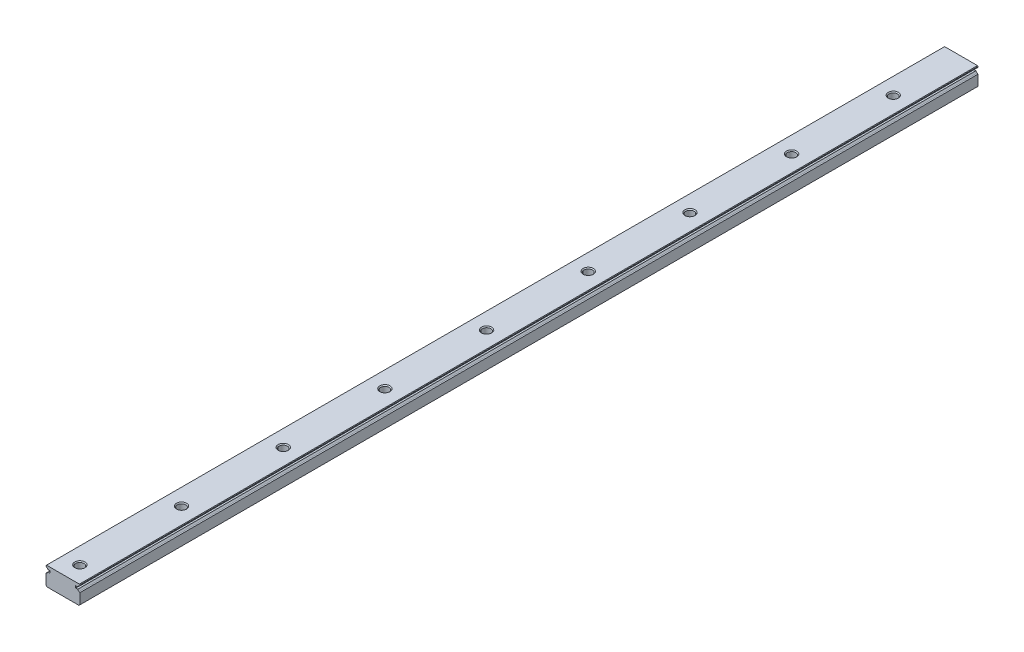
from build123d import *

# Parameters (mm, degrees)
ESQUISSE1_W             = 20
ESQUISSE1_H             = 530
BOSS_EXTRU_1_DEPTH      = 11
ENL_V_MAT_EXTRU_1_DEPTH = 531.208449574
ENL_V_MAT_EXTRU_2_DEPTH = 531.208449574
ENL_V_MAT_EXTRU_3_DEPTH = 531.208449574
ENL_V_MAT_EXTRU_4_DEPTH = 531.208449574
PER_AGE1_D              = 4.917
PER_AGE2_D              = 4.917
CHANFREIN1_SIZE         = 0.5415
CHANFREIN2_SIZE         = 0.3


with BuildPart() as part:
    # Esquisse1 → Boss.-Extru.1 (new body)
    with BuildSketch(Plane.XZ):
        with Locations((0, -15)):
            Rectangle(ESQUISSE1_W, ESQUISSE1_H)
    extrude(amount=-BOSS_EXTRU_1_DEPTH)

    # Esquisse2 → Enlèv. mat.-Extru.1 (cut, through all)
    with BuildSketch(Plane(origin=(0, 0, -280), x_dir=(-1, 0, 0), z_dir=(0, 0, -1))):
        with BuildLine():
            Line((10, 7.9), (10, 10.22385))
            Line((10, 10.22385), (9.440021531, 9.900556887))
            ThreePointArc((9.440021531, 9.900556887), (9.015681976, 9.557293765), (8.71772889, 9.1))
            Line((8.71772889, 9.1), (7.5, 9.1))
            Line((7.5, 9.1), (7.5, 7.9))
            Line((7.5, 7.9), (10, 7.9))
        make_face()
    extrude(amount=-ENL_V_MAT_EXTRU_1_DEPTH, mode=Mode.SUBTRACT)

    # Esquisse3 → Enlèv. mat.-Extru.2 (cut, through all)
    with BuildSketch(Plane(origin=(0, 0, -280), x_dir=(-1, 0, 0), z_dir=(0, 0, -1))):
        with BuildLine():
            Line((9.440021531, 7.099443113), (10, 6.77615))
            Line((10, 6.77615), (10, 7.9))
            Line((10, 7.9), (8.71772889, 7.9))
            ThreePointArc((8.71772889, 7.9), (9.015681976, 7.442706235), (9.440021531, 7.099443113))
        make_face()
    extrude(amount=-ENL_V_MAT_EXTRU_2_DEPTH, mode=Mode.SUBTRACT)

    # Esquisse4 → Enlèv. mat.-Extru.3 (cut, through all)
    with BuildSketch(Plane(origin=(0, 0, -280), x_dir=(-1, 0, 0), z_dir=(0, 0, -1))):
        with BuildLine():
            Line((-10, 9.1), (-10, 6.77615))
            Line((-10, 6.77615), (-9.440021531, 7.099443113))
            ThreePointArc((-9.440021531, 7.099443113), (-9.015681976, 7.442706235), (-8.71772889, 7.9))
            Line((-8.71772889, 7.9), (-7.5, 7.9))
            Line((-7.5, 7.9), (-7.5, 9.1))
            Line((-7.5, 9.1), (-10, 9.1))
        make_face()
    extrude(amount=-ENL_V_MAT_EXTRU_3_DEPTH, mode=Mode.SUBTRACT)

    # Esquisse5 → Enlèv. mat.-Extru.4 (cut, through all)
    with BuildSketch(Plane(origin=(0, 0, -280), x_dir=(-1, 0, 0), z_dir=(0, 0, -1))):
        with BuildLine():
            Line((-9.440021531, 9.900556887), (-10, 10.22385))
            Line((-10, 10.22385), (-10, 9.1))
            Line((-10, 9.1), (-8.71772889, 9.1))
            ThreePointArc((-8.71772889, 9.1), (-9.015681976, 9.557293765), (-9.440021531, 9.900556887))
        make_face()
    extrude(amount=-ENL_V_MAT_EXTRU_4_DEPTH, mode=Mode.SUBTRACT)

    # Perçage1 (through all)
    with Locations(Plane(origin=(0, 11, 0), x_dir=(1, 0, 0), z_dir=(0, 1, 0))):
        with Locations((0, -180), (0, -120), (0, 60), (0, 180)):
            Hole(PER_AGE1_D / 2)

    # Perçage2 (through all)
    with Locations(Plane(origin=(0, 0, 0), x_dir=(-1, 0, 0), z_dir=(0, -1, 0))):
        with Locations((0, -240), (0, -60), (0, 0), (0, 120), (0, 240)):
            Hole(PER_AGE2_D / 2)

    # Chanfrein1
    chanfrein1_edges = [part.edges().sort_by_distance(p)[0] for p in [
        (2.4585, 11, 180),
        (2.4585, 0, 180),
        (-2.4585, 0, -240),
        (-2.4585, 11, -240),
        (-2.4585, 0, -120),
        (-2.4585, 11, -120),
        (-2.4585, 0, 0),
        (-2.4585, 11, 0),
        (-2.4585, 0, 60),
        (-2.4585, 11, 60),
        (-2.4585, 0, 240),
        (-2.4585, 11, 240),
        (10, 0, -15),
        (-10, 0, -15),
        (2.4585, 11, -180),
        (2.4585, 0, -180),
        (2.4585, 11, -60),
        (2.4585, 0, -60),
        (2.4585, 11, 120),
        (2.4585, 0, 120),
    ]]
    chamfer(chanfrein1_edges, length=CHANFREIN1_SIZE)

    # Chanfrein2
    chanfrein2_edges = [part.edges().sort_by_distance(p)[0] for p in [
        (10, 11, -15),
        (-10, 11, -15),
    ]]
    chamfer(chanfrein2_edges, length=CHANFREIN2_SIZE)


solid = part.part
